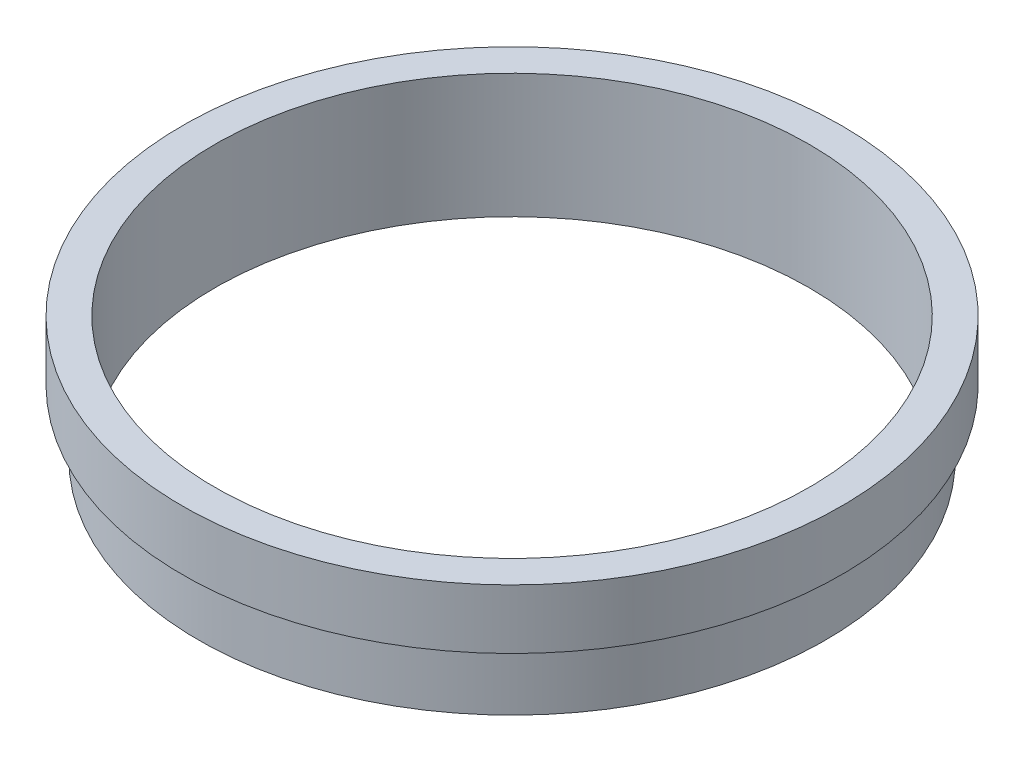
from build123d import *

# Parameters (mm, degrees)
SKETCH1_W   = 1.5
SKETCH1_H   = 11.5
SKETCH1_H_2 = 5.5


with BuildPart() as part:
    # Sketch1 → Revolve1 (revolve)
    with BuildSketch(Plane.XY, mode=Mode.PRIVATE) as revolve1_sk:
        with Locations((28.25, 5.75)):
            Rectangle(SKETCH1_W, SKETCH1_H)
        with Locations((29.75, 8.75)):
            Rectangle(SKETCH1_W, SKETCH1_H_2)
    revolve(revolve1_sk.sketch.rotate(Axis((0, 0, 0), (0, 1, 0)), 90), axis=Axis((0, 0, 0), (0, 1, 0)))


solid = part.part
